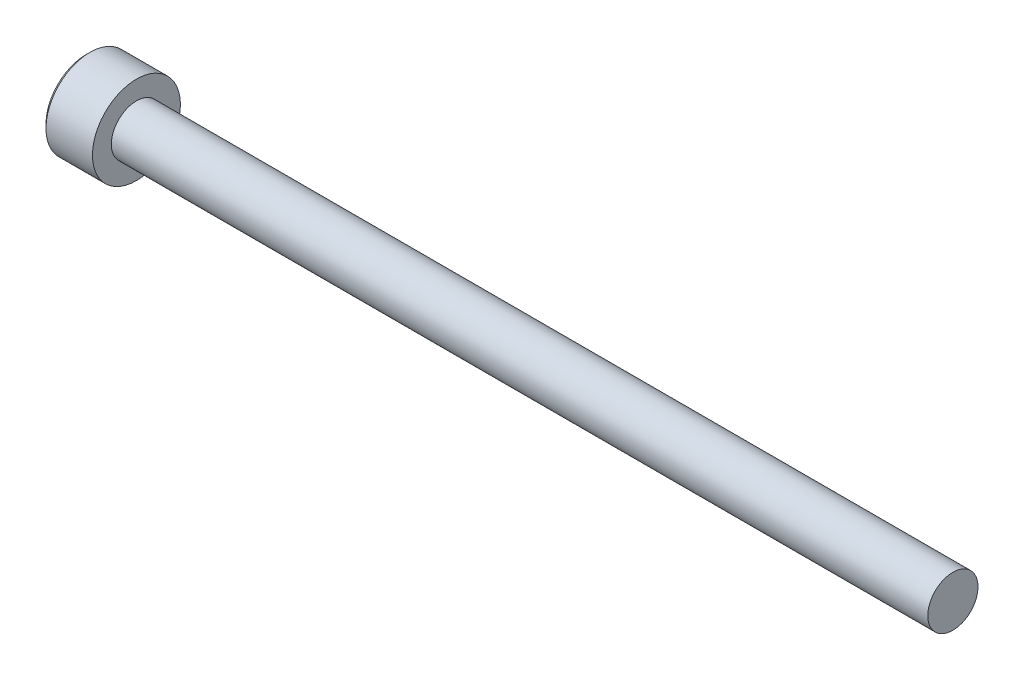
from build123d import *

# Parameters (mm, degrees)
CUT_EXTRUDE1_DEPTH = 2


with BuildPart() as part:
    # Sketch1 → Revolve1 (revolve)
    with BuildSketch(Plane.XY, mode=Mode.PRIVATE) as revolve1_sk:
        Polygon((-4, 0), (-4, 3.2), (-3.7, 3.5), (0, 3.5), (0, 2), (65, 2), (65, 0), align=None)
    revolve(revolve1_sk.sketch.rotate(Axis((-4, 0, 0), (1, 0, 0)), 180), axis=Axis((-4, 0, 0), (1, 0, 0)))

    # Sketch2 → Cut-Extrude1 (cut)
    with BuildSketch(Plane.ZY.offset(4)):
        Polygon((0, 1.732050808), (-1.5, 0.866025404), (-1.5, -0.866025404), (0, -1.732050808), (1.5, -0.866025404), (1.5, 0.866025404), align=None)
    extrude(amount=-CUT_EXTRUDE1_DEPTH, mode=Mode.SUBTRACT)

    # Sketch3 → Cut-Revolve1 (revolve, cut)
    with BuildSketch(Plane.XY, mode=Mode.PRIVATE) as cut_revolve1_sk:
        Polygon((-2, 0), (-2, 1.5), (-1.098709071, 0), align=None)
    revolve(cut_revolve1_sk.sketch.rotate(Axis((-2, 0, 0), (1, 0, 0)), 180), axis=Axis((-2, 0, 0), (1, 0, 0)), mode=Mode.SUBTRACT)


solid = part.part
